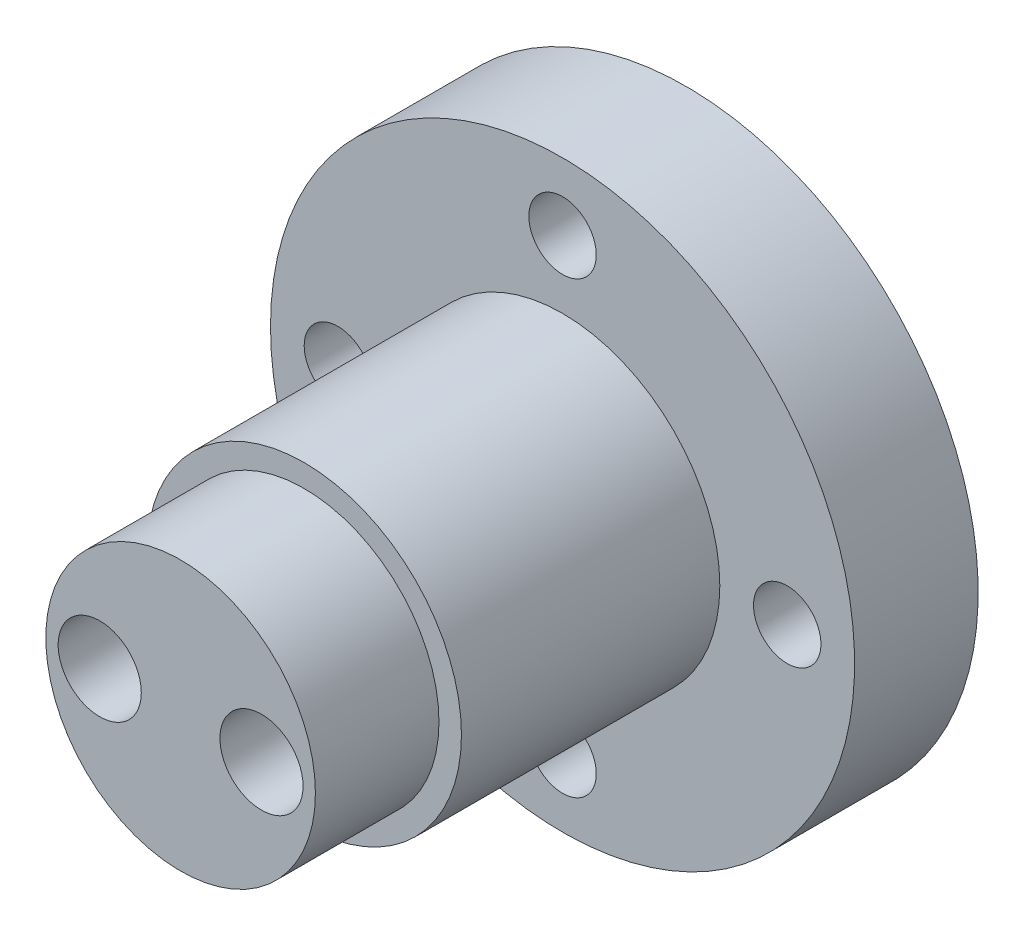
from build123d import *

# Parameters (mm, degrees)
SKETCH1_R           = 7
BOSS_EXTRUDE1_DEPTH = 11.5
SKETCH2_R           = 6
BOSS_EXTRUDE2_DEPTH = 5.5
SKETCH3_R           = 13
SKETCH3_R_2         = 1.5
BOSS_EXTRUDE3_DEPTH = 5.5
SKETCH4_R           = 1.85
CUT_EXTRUDE1_DEPTH  = 30.055980452


with BuildPart() as part:
    # Sketch1 → Boss-Extrude1 (new body)
    with BuildSketch(Plane.XY):
        Circle(SKETCH1_R)
    extrude(amount=BOSS_EXTRUDE1_DEPTH)

    # Sketch2 → Boss-Extrude2 (add)
    with BuildSketch(Plane.XY.offset(11.5)):
        Circle(SKETCH2_R)
    extrude(amount=BOSS_EXTRUDE2_DEPTH)

    # Sketch3 → Boss-Extrude3 (add)
    with BuildSketch(Plane(origin=(0, 0, 0), x_dir=(-1, 0, 0), z_dir=(0, 0, -1))):
        Circle(SKETCH3_R)
        with Locations((10, 0)):
            Circle(SKETCH3_R_2, mode=Mode.SUBTRACT)
        with Locations((0, -10)):
            Circle(SKETCH3_R_2, mode=Mode.SUBTRACT)
        with Locations((-10, 0)):
            Circle(SKETCH3_R_2, mode=Mode.SUBTRACT)
        with Locations((0, 10)):
            Circle(SKETCH3_R_2, mode=Mode.SUBTRACT)
    extrude(amount=BOSS_EXTRUDE3_DEPTH)

    # Sketch4 → Cut-Extrude1 (cut, through all)
    with BuildSketch(Plane.XY.offset(17)):
        with Locations((3.6, -3.04e-07)):
            Circle(SKETCH4_R)
        with Locations((-3.6, 0)):
            Circle(SKETCH4_R)
    extrude(amount=-CUT_EXTRUDE1_DEPTH, mode=Mode.SUBTRACT)


solid = part.part
